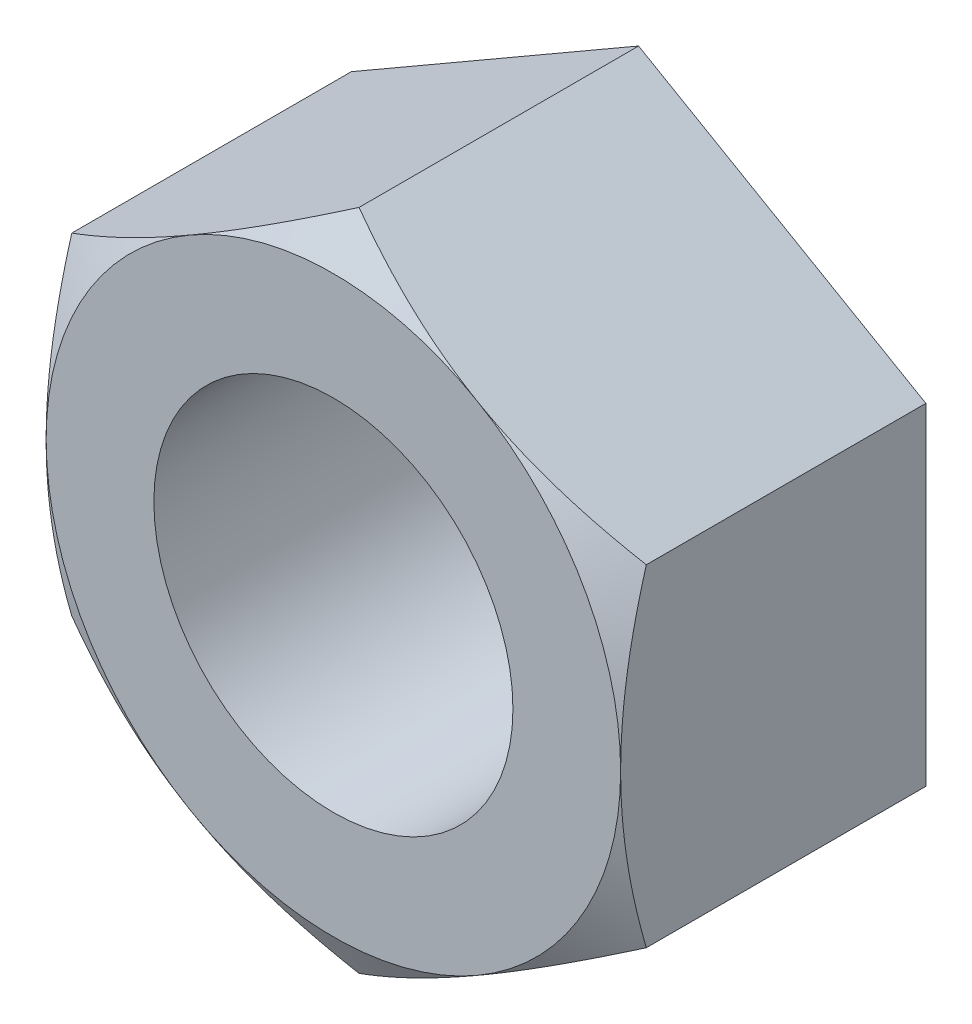
from build123d import *

# Parameters (mm, degrees)
SKETCH1_R         = 3.96875
EXTRUDE1_DEPTH    = 3.3734375
SKETCH7_OUTSIDE_W = 106.796
SKETCH7_OUTSIDE_H = 108.76
SKETCH7_OUTSIDE_R = 6.35
EXTRUDE2_DEPTH    = 25.4
EXTRUDE2_DRAFT    = -60


with BuildPart() as part:
    # Sketch1 → Extrude1 (new, symmetric)
    with BuildSketch(Plane.XY):
        Polygon((-6.35, 3.666174209), (-6.35, -3.666174209), (0, -7.332348419), (6.35, -3.666174209), (6.35, 3.666174209), (0, 7.332348419), align=None)
        Circle(SKETCH1_R, mode=Mode.SUBTRACT)
    extrude(amount=EXTRUDE1_DEPTH, both=True)


with BuildPart() as extrude2_tool:
    # Sketch7 outside → Extrude2 (with draft: the straight prism first)
    with BuildSketch(Plane.XY.offset(3.3734375)):
        Rectangle(SKETCH7_OUTSIDE_W, SKETCH7_OUTSIDE_H)
        Circle(SKETCH7_OUTSIDE_R, mode=Mode.SUBTRACT)
    extrude(amount=-EXTRUDE2_DEPTH)
    # Extrude2: the draft: its side faces are tilted about the plane it starts from
    extrude2_sides = [extrude2_tool.faces().sort_by_distance(p)[0] for p in [
        (0, -54.38, -9.3265625),
        (53.398, 0, -9.3265625),
        (0, 54.38, -9.3265625),
        (-53.398, 0, -9.3265625),
        (-6.35, 0, -9.3265625),
    ]]
    draft(extrude2_sides, Plane.XY.offset(3.3734375), EXTRUDE2_DRAFT)


with BuildPart() as part_1:
    add(part.part)

    # Extrude2: cut by extrude2_tool
    add(extrude2_tool.part, mode=Mode.SUBTRACT)


solid = part_1.part
